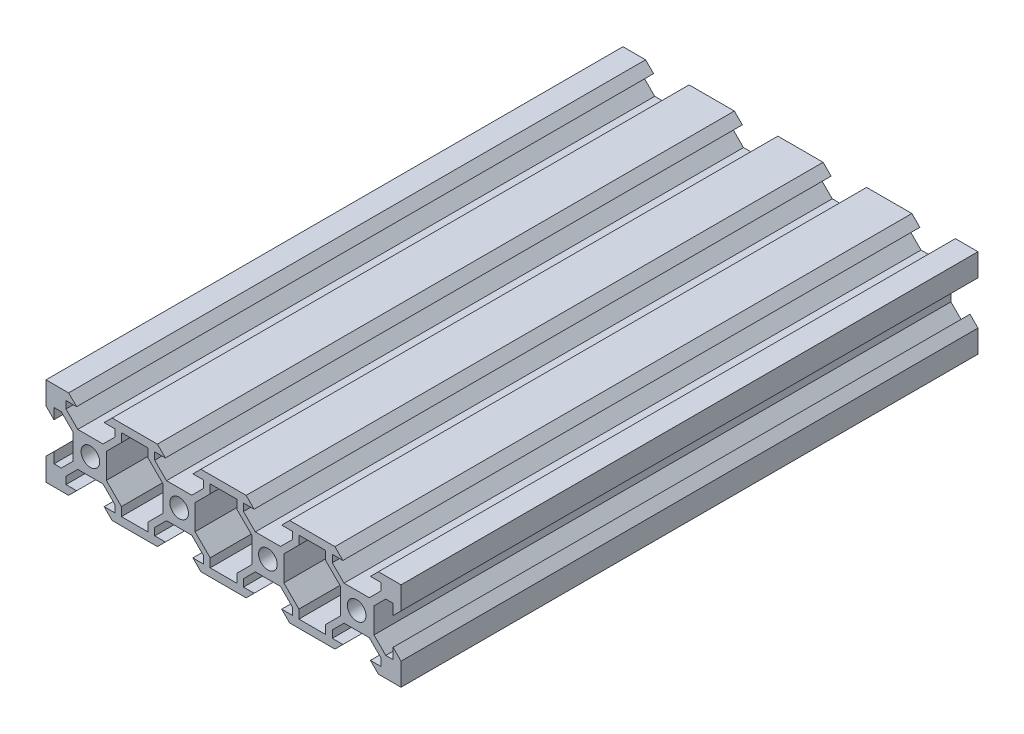
from build123d import *

# Parameters (mm, degrees)
ESQUISSE1_W             = 80
ESQUISSE1_H             = 20
BOSS_EXTRU_1_DEPTH      = 130
ENL_V_MAT_EXTRU_1_REACH = 148.098
ESQUISSE2_R             = 2.1
ENL_V_MAT_EXTRU_2_REACH = 148.098


with BuildPart() as part:
    # Esquisse1 → Boss.-Extru.1 (new body)
    with BuildSketch(Plane.XY):
        with Locations((-25.62771875, -1.733873274)):
            Rectangle(ESQUISSE1_W, ESQUISSE1_H)
    extrude(amount=BOSS_EXTRU_1_DEPTH)

    # Esquisse2 → Enlèv. mat.-Extru.1 (cut, up to next)
    with BuildSketch(Plane(origin=(0, 0, 0), x_dir=(-1, 0, 0), z_dir=(0, 0, -1)), mode=Mode.PRIVATE) as enl_v_mat_extru_1_sk1:
        with Locations((55.62771875, -1.733873274)):
            Circle(ESQUISSE2_R)
    enl_v_mat_extru_1_tool1 = extrude(enl_v_mat_extru_1_sk1.sketch, amount=-ENL_V_MAT_EXTRU_1_REACH, mode=Mode.PRIVATE) & part.part
    # Esquisse2 → Enlèv. mat.-Extru.1 (cut, up to next)
    with BuildSketch(Plane(origin=(0, 0, 0), x_dir=(-1, 0, 0), z_dir=(0, 0, -1)), mode=Mode.PRIVATE) as enl_v_mat_extru_1_sk2:
        with Locations((35.62771875, -1.733873274)):
            Circle(ESQUISSE2_R)
    enl_v_mat_extru_1_tool2 = extrude(enl_v_mat_extru_1_sk2.sketch, amount=-ENL_V_MAT_EXTRU_1_REACH, mode=Mode.PRIVATE) & part.part
    # Esquisse2 → Enlèv. mat.-Extru.1 (cut, up to next)
    with BuildSketch(Plane(origin=(0, 0, 0), x_dir=(-1, 0, 0), z_dir=(0, 0, -1)), mode=Mode.PRIVATE) as enl_v_mat_extru_1_sk3:
        with Locations((15.62771875, -1.733873274)):
            Circle(ESQUISSE2_R)
    enl_v_mat_extru_1_tool3 = extrude(enl_v_mat_extru_1_sk3.sketch, amount=-ENL_V_MAT_EXTRU_1_REACH, mode=Mode.PRIVATE) & part.part
    # Esquisse2 → Enlèv. mat.-Extru.1 (cut, up to next)
    with BuildSketch(Plane(origin=(0, 0, 0), x_dir=(-1, 0, 0), z_dir=(0, 0, -1)), mode=Mode.PRIVATE) as enl_v_mat_extru_1_sk4:
        with Locations((-4.37228125, -1.733873274)):
            Circle(ESQUISSE2_R)
    enl_v_mat_extru_1_tool4 = extrude(enl_v_mat_extru_1_sk4.sketch, amount=-ENL_V_MAT_EXTRU_1_REACH, mode=Mode.PRIVATE) & part.part
    # Esquisse2 → Enlèv. mat.-Extru.1 (cut, up to next)
    with BuildSketch(Plane(origin=(0, 0, 0), x_dir=(-1, 0, 0), z_dir=(0, 0, -1)), mode=Mode.PRIVATE) as enl_v_mat_extru_1_sk5:
        Polygon((50.72771875, 8.266126726), (60.52771875, 8.266126726), (58.72771875, 6.466126726), (61.12771875, 6.466126726), (61.12771875, 4.826126726), (58.46771875, 2.166126726), (52.78771875, 2.166126726), (50.12771875, 4.826126726), (50.12771875, 6.466126726), (52.52771875, 6.466126726), align=None)
    enl_v_mat_extru_1_tool5 = extrude(enl_v_mat_extru_1_sk5.sketch, amount=-ENL_V_MAT_EXTRU_1_REACH, mode=Mode.PRIVATE) & part.part
    # Esquisse2 → Enlèv. mat.-Extru.1 (cut, up to next)
    with BuildSketch(Plane(origin=(0, 0, 0), x_dir=(-1, 0, 0), z_dir=(0, 0, -1)), mode=Mode.PRIVATE) as enl_v_mat_extru_1_sk6:
        Polygon((65.62771875, 3.166126726), (65.62771875, -6.633873274), (63.82771875, -4.833873274), (63.82771875, -7.233873274), (62.18771875, -7.233873274), (59.52771875, -4.573873274), (59.52771875, 1.106126726), (62.18771875, 3.766126726), (63.82771875, 3.766126726), (63.82771875, 1.366126726), align=None)
    enl_v_mat_extru_1_tool6 = extrude(enl_v_mat_extru_1_sk6.sketch, amount=-ENL_V_MAT_EXTRU_1_REACH, mode=Mode.PRIVATE) & part.part
    # Esquisse2 → Enlèv. mat.-Extru.1 (cut, up to next)
    with BuildSketch(Plane(origin=(0, 0, 0), x_dir=(-1, 0, 0), z_dir=(0, 0, -1)), mode=Mode.PRIVATE) as enl_v_mat_extru_1_sk7:
        Polygon((60.52771875, -11.733873274), (50.72771875, -11.733873274), (52.52771875, -9.933873274), (50.12771875, -9.933873274), (50.12771875, -8.293873274), (52.78771875, -5.633873274), (58.46771875, -5.633873274), (61.12771875, -8.293873274), (61.12771875, -9.933873274), (58.72771875, -9.933873274), align=None)
    enl_v_mat_extru_1_tool7 = extrude(enl_v_mat_extru_1_sk7.sketch, amount=-ENL_V_MAT_EXTRU_1_REACH, mode=Mode.PRIVATE) & part.part
    # Esquisse2 → Enlèv. mat.-Extru.1 (cut, up to next)
    with BuildSketch(Plane(origin=(0, 0, 0), x_dir=(-1, 0, 0), z_dir=(0, 0, -1)), mode=Mode.PRIVATE) as enl_v_mat_extru_1_sk8:
        Polygon((30.72771875, 8.266126726), (40.52771875, 8.266126726), (38.72771875, 6.466126726), (41.12771875, 6.466126726), (41.12771875, 4.826126726), (38.46771875, 2.166126726), (32.78771875, 2.166126726), (30.12771875, 4.826126726), (30.12771875, 6.466126726), (32.52771875, 6.466126726), align=None)
    enl_v_mat_extru_1_tool8 = extrude(enl_v_mat_extru_1_sk8.sketch, amount=-ENL_V_MAT_EXTRU_1_REACH, mode=Mode.PRIVATE) & part.part
    # Esquisse2 → Enlèv. mat.-Extru.1 (cut, up to next)
    with BuildSketch(Plane(origin=(0, 0, 0), x_dir=(-1, 0, 0), z_dir=(0, 0, -1)), mode=Mode.PRIVATE) as enl_v_mat_extru_1_sk9:
        Polygon((40.52771875, -11.733873274), (30.72771875, -11.733873274), (32.52771875, -9.933873274), (30.12771875, -9.933873274), (30.12771875, -8.293873274), (32.78771875, -5.633873274), (38.46771875, -5.633873274), (41.12771875, -8.293873274), (41.12771875, -9.933873274), (38.72771875, -9.933873274), align=None)
    enl_v_mat_extru_1_tool9 = extrude(enl_v_mat_extru_1_sk9.sketch, amount=-ENL_V_MAT_EXTRU_1_REACH, mode=Mode.PRIVATE) & part.part
    # Esquisse2 → Enlèv. mat.-Extru.1 (cut, up to next)
    with BuildSketch(Plane(origin=(0, 0, 0), x_dir=(-1, 0, 0), z_dir=(0, 0, -1)), mode=Mode.PRIVATE) as enl_v_mat_extru_1_sk10:
        Polygon((10.72771875, 8.266126726), (20.52771875, 8.266126726), (18.72771875, 6.466126726), (21.12771875, 6.466126726), (21.12771875, 4.826126726), (18.46771875, 2.166126726), (12.78771875, 2.166126726), (10.12771875, 4.826126726), (10.12771875, 6.466126726), (12.52771875, 6.466126726), align=None)
    enl_v_mat_extru_1_tool10 = extrude(enl_v_mat_extru_1_sk10.sketch, amount=-ENL_V_MAT_EXTRU_1_REACH, mode=Mode.PRIVATE) & part.part
    # Esquisse2 → Enlèv. mat.-Extru.1 (cut, up to next)
    with BuildSketch(Plane(origin=(0, 0, 0), x_dir=(-1, 0, 0), z_dir=(0, 0, -1)), mode=Mode.PRIVATE) as enl_v_mat_extru_1_sk11:
        Polygon((20.52771875, -11.733873274), (10.72771875, -11.733873274), (12.52771875, -9.933873274), (10.12771875, -9.933873274), (10.12771875, -8.293873274), (12.78771875, -5.633873274), (18.46771875, -5.633873274), (21.12771875, -8.293873274), (21.12771875, -9.933873274), (18.72771875, -9.933873274), align=None)
    enl_v_mat_extru_1_tool11 = extrude(enl_v_mat_extru_1_sk11.sketch, amount=-ENL_V_MAT_EXTRU_1_REACH, mode=Mode.PRIVATE) & part.part
    # Esquisse2 → Enlèv. mat.-Extru.1 (cut, up to next)
    with BuildSketch(Plane(origin=(0, 0, 0), x_dir=(-1, 0, 0), z_dir=(0, 0, -1)), mode=Mode.PRIVATE) as enl_v_mat_extru_1_sk12:
        Polygon((-9.27228125, 8.266126726), (0.52771875, 8.266126726), (-1.27228125, 6.466126726), (1.12771875, 6.466126726), (1.12771875, 4.826126726), (-1.53228125, 2.166126726), (-7.21228125, 2.166126726), (-9.87228125, 4.826126726), (-9.87228125, 6.466126726), (-7.47228125, 6.466126726), align=None)
    enl_v_mat_extru_1_tool12 = extrude(enl_v_mat_extru_1_sk12.sketch, amount=-ENL_V_MAT_EXTRU_1_REACH, mode=Mode.PRIVATE) & part.part
    # Esquisse2 → Enlèv. mat.-Extru.1 (cut, up to next)
    with BuildSketch(Plane(origin=(0, 0, 0), x_dir=(-1, 0, 0), z_dir=(0, 0, -1)), mode=Mode.PRIVATE) as enl_v_mat_extru_1_sk13:
        Polygon((0.52771875, -11.733873274), (-9.27228125, -11.733873274), (-7.47228125, -9.933873274), (-9.87228125, -9.933873274), (-9.87228125, -8.293873274), (-7.21228125, -5.633873274), (-1.53228125, -5.633873274), (1.12771875, -8.293873274), (1.12771875, -9.933873274), (-1.27228125, -9.933873274), align=None)
    enl_v_mat_extru_1_tool13 = extrude(enl_v_mat_extru_1_sk13.sketch, amount=-ENL_V_MAT_EXTRU_1_REACH, mode=Mode.PRIVATE) & part.part
    # Esquisse2 → Enlèv. mat.-Extru.1 (cut, up to next)
    with BuildSketch(Plane(origin=(0, 0, 0), x_dir=(-1, 0, 0), z_dir=(0, 0, -1)), mode=Mode.PRIVATE) as enl_v_mat_extru_1_sk14:
        Polygon((-14.37228125, -6.633873274), (-14.37228125, 3.166126726), (-12.57228125, 1.366126726), (-12.57228125, 3.766126726), (-10.93228125, 3.766126726), (-8.27228125, 1.106126726), (-8.27228125, -4.573873274), (-10.93228125, -7.233873274), (-12.57228125, -7.233873274), (-12.57228125, -4.833873274), align=None)
    enl_v_mat_extru_1_tool14 = extrude(enl_v_mat_extru_1_sk14.sketch, amount=-ENL_V_MAT_EXTRU_1_REACH, mode=Mode.PRIVATE) & part.part
    add(enl_v_mat_extru_1_tool1.solids().sort_by_distance((-55.627719, -1.733873, 0))[0], mode=Mode.SUBTRACT)
    add(enl_v_mat_extru_1_tool2.solids().sort_by_distance((-35.627719, -1.733873, 0))[0], mode=Mode.SUBTRACT)
    add(enl_v_mat_extru_1_tool3.solids().sort_by_distance((-15.627719, -1.733873, 0))[0], mode=Mode.SUBTRACT)
    add(enl_v_mat_extru_1_tool4.solids().sort_by_distance((4.372281, -1.733873, 0))[0], mode=Mode.SUBTRACT)
    add(enl_v_mat_extru_1_tool5.solids().sort_by_distance((-55.627719, 5.301599, 0))[0], mode=Mode.SUBTRACT)
    add(enl_v_mat_extru_1_tool6.solids().sort_by_distance((-62.663191, -1.733873, 0))[0], mode=Mode.SUBTRACT)
    add(enl_v_mat_extru_1_tool7.solids().sort_by_distance((-55.627719, -8.769346, 0))[0], mode=Mode.SUBTRACT)
    add(enl_v_mat_extru_1_tool8.solids().sort_by_distance((-35.627719, 5.301599, 0))[0], mode=Mode.SUBTRACT)
    add(enl_v_mat_extru_1_tool9.solids().sort_by_distance((-35.627719, -8.769346, 0))[0], mode=Mode.SUBTRACT)
    add(enl_v_mat_extru_1_tool10.solids().sort_by_distance((-15.627719, 5.301599, 0))[0], mode=Mode.SUBTRACT)
    add(enl_v_mat_extru_1_tool11.solids().sort_by_distance((-15.627719, -8.769346, 0))[0], mode=Mode.SUBTRACT)
    add(enl_v_mat_extru_1_tool12.solids().sort_by_distance((4.372281, 5.301599, 0))[0], mode=Mode.SUBTRACT)
    add(enl_v_mat_extru_1_tool13.solids().sort_by_distance((4.372281, -8.769346, 0))[0], mode=Mode.SUBTRACT)
    add(enl_v_mat_extru_1_tool14.solids().sort_by_distance((11.407754, -1.733873, 0))[0], mode=Mode.SUBTRACT)

    # Esquisse3 → Enlèv. mat.-Extru.2 (cut, up to next)
    with BuildSketch(Plane(origin=(0, 0, 0), x_dir=(-1, 0, 0), z_dir=(0, 0, -1)), mode=Mode.PRIVATE) as enl_v_mat_extru_2_sk1:
        Polygon((2.618256699, 6.466126726), (8.637180802, 6.466126726), (8.637180802, 4.506126726), (12.037180802, 1.106126726), (12.037180802, -4.573873274), (8.637180802, -7.973873274), (8.637180802, -9.933873274), (2.618256699, -9.933873274), (2.618256699, -7.973873274), (-0.781743301, -4.573873274), (-0.781743301, 1.106126726), (2.618256699, 4.506126726), align=None)
    enl_v_mat_extru_2_tool1 = extrude(enl_v_mat_extru_2_sk1.sketch, amount=-ENL_V_MAT_EXTRU_2_REACH, mode=Mode.PRIVATE) & part.part
    # Esquisse3 → Enlèv. mat.-Extru.2 (cut, up to next)
    with BuildSketch(Plane(origin=(0, 0, 0), x_dir=(-1, 0, 0), z_dir=(0, 0, -1)), mode=Mode.PRIVATE) as enl_v_mat_extru_2_sk2:
        Polygon((22.618256699, 6.466126726), (28.637180802, 6.466126726), (28.637180802, 4.506126726), (32.037180802, 1.106126726), (32.037180802, -4.573873274), (28.637180802, -7.973873274), (28.637180802, -9.933873274), (22.618256699, -9.933873274), (22.618256699, -7.973873274), (19.218256699, -4.573873274), (19.218256699, 1.106126726), (22.618256699, 4.506126726), align=None)
    enl_v_mat_extru_2_tool2 = extrude(enl_v_mat_extru_2_sk2.sketch, amount=-ENL_V_MAT_EXTRU_2_REACH, mode=Mode.PRIVATE) & part.part
    # Esquisse3 → Enlèv. mat.-Extru.2 (cut, up to next)
    with BuildSketch(Plane(origin=(0, 0, 0), x_dir=(-1, 0, 0), z_dir=(0, 0, -1)), mode=Mode.PRIVATE) as enl_v_mat_extru_2_sk3:
        Polygon((42.618256699, 6.466126726), (48.637180802, 6.466126726), (48.637180802, 4.506126726), (52.037180802, 1.106126726), (52.037180802, -4.573873274), (48.637180802, -7.973873274), (48.637180802, -9.933873274), (42.618256699, -9.933873274), (42.618256699, -7.973873274), (39.218256699, -4.573873274), (39.218256699, 1.106126726), (42.618256699, 4.506126726), align=None)
    enl_v_mat_extru_2_tool3 = extrude(enl_v_mat_extru_2_sk3.sketch, amount=-ENL_V_MAT_EXTRU_2_REACH, mode=Mode.PRIVATE) & part.part
    add(enl_v_mat_extru_2_tool1.solids().sort_by_distance((-5.627719, -1.733873, 0))[0], mode=Mode.SUBTRACT)
    add(enl_v_mat_extru_2_tool2.solids().sort_by_distance((-25.627719, -1.733873, 0))[0], mode=Mode.SUBTRACT)
    add(enl_v_mat_extru_2_tool3.solids().sort_by_distance((-45.627719, -1.733873, 0))[0], mode=Mode.SUBTRACT)


solid = part.part
